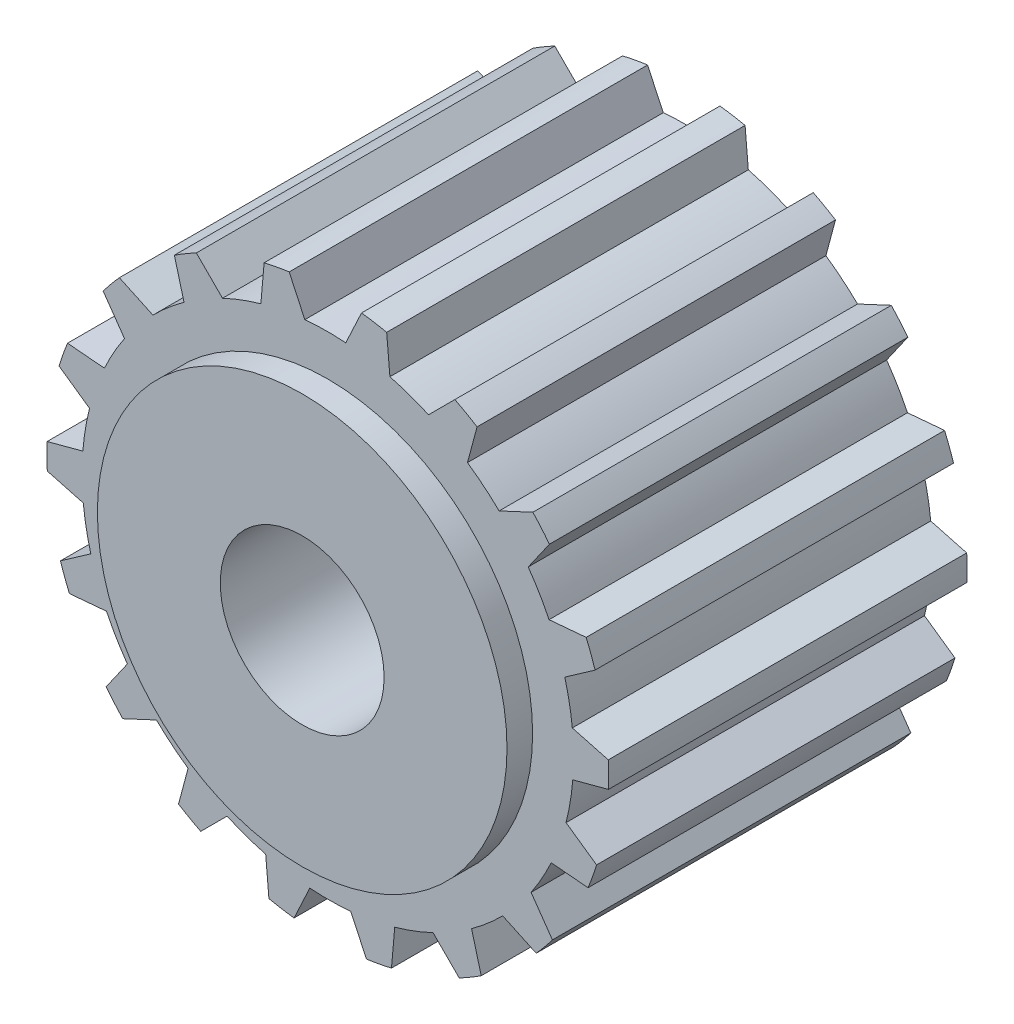
from build123d import *

# Parameters (mm, degrees)
ESQUISSE1_R                  = 13.715
ESQUISSE1_R_2                = 4
BASE_EXTRUSION_DEPTH         = 10
ENL_V_MAT_EXTRU_1_DEPTH      = 28.860410083
R_P_TITION_CIRCULAIRE1_COUNT = 18
ENL_V_START                  = -1.25
ESQUISSE3_R                  = 13.715
ESQUISSE3_R_2                = 10
ENL_V_MAT_EXTRU_2_DEPTH      = 1.25
ESQUISSE4_R                  = 13.715
ESQUISSE4_R_2                = 10
ENL_V_MAT_EXTRU_3_DEPTH      = 1.25


with BuildPart() as part:
    # Esquisse1 → Base-Extrusion (new, symmetric)
    with BuildSketch(Plane.XY):
        Circle(ESQUISSE1_R)
        Circle(ESQUISSE1_R_2, mode=Mode.SUBTRACT)
    extrude(amount=BASE_EXTRUSION_DEPTH, both=True)

    # Esquisse2 → Enlèv. mat.-Extru.1 (cut, through all)
    with BuildSketch(Plane.XY.offset(10)):
        with BuildLine():
            Line((0.878200621, 11.96782201), (1.646660653, 13.615789867))
            ThreePointArc((1.646660653, 13.615789867), (-0.120274569, 13.714472612), (-1.885207275, 13.584815734))
            Line((-1.885207275, 13.584815734), (-1.121695723, 11.947459927))
            ThreePointArc((-1.121695723, 11.947459927), (-0.1221725, 11.999378062), (0.878200621, 11.96782201))
        make_face()
    enl_v_mat_extru_1 = extrude(amount=-ENL_V_MAT_EXTRU_1_DEPTH, mode=Mode.SUBTRACT)

    # Répétition circulaire1: Enlèv. mat.-Extru.1 ×18 about axis
    r_p_tition_circulaire1_axis = Axis((0, 0, 0), (0, 0, 1))
    for i in range(1, R_P_TITION_CIRCULAIRE1_COUNT):
        add(enl_v_mat_extru_1.rotate(r_p_tition_circulaire1_axis, i * 360 / R_P_TITION_CIRCULAIRE1_COUNT), mode=Mode.SUBTRACT)

    # Esquisse3 → Enlèv. mat.-Extru.2 (cut)
    with BuildSketch(Plane(origin=(0, 0, -10), x_dir=(-1, 0, 0), z_dir=(0, 0, -1)).offset(ENL_V_START)):
        Circle(ESQUISSE3_R)
        Circle(ESQUISSE3_R_2, mode=Mode.SUBTRACT)
    extrude(amount=ENL_V_MAT_EXTRU_2_DEPTH, mode=Mode.SUBTRACT)

    # Esquisse4 → Enlèv. mat.-Extru.3 (cut)
    with BuildSketch(Plane.XY.offset(10)):
        Circle(ESQUISSE4_R)
        with Locations(Location((0, 0, 0), (0, 0, 180))):
            Circle(ESQUISSE4_R_2, mode=Mode.SUBTRACT)
    extrude(amount=-ENL_V_MAT_EXTRU_3_DEPTH, mode=Mode.SUBTRACT)


solid = part.part
